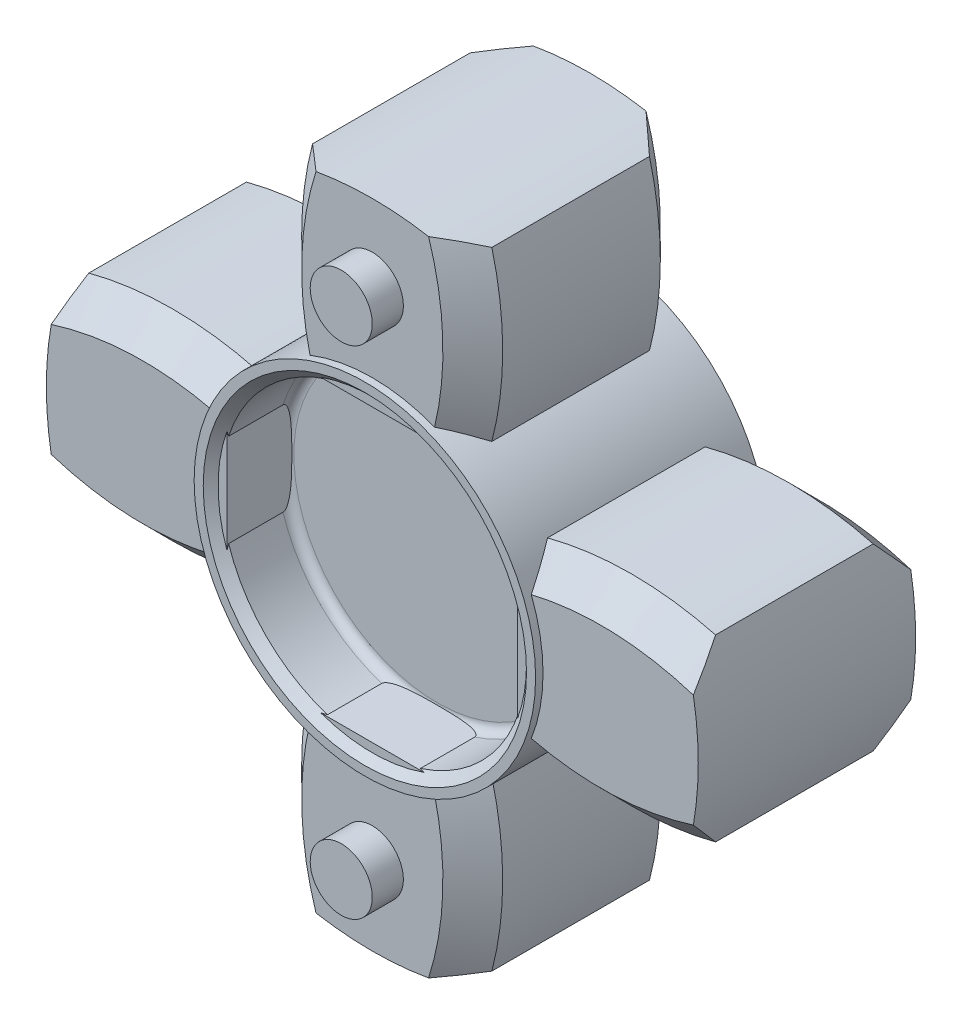
from build123d import *

# Parameters (mm, degrees)
BOSS_EXTRUDE1_DEPTH          = 5.93852
BOSS_EXTRUDE1_DEPTH_BACK     = 5.93852
SKETCH4_R                    = 8.73125
SKETCH4_R_2                  = 7.80161
BOSS_EXTRUDE2_DEPTH          = 2.23266
BOSS_EXTRUDE2_DEPTH_BACK     = 2.23266
SKETCH5_R                    = 7.80161
FILLET1_R                    = 0.46482
CHAMFER1_SIZE                = 0.46482
BOSS_EXTRUDE3_DEPTH          = 5.55879
CHAMFER2_SIZE                = 1.528233333
CIRPATTERN1_COUNT            = 4
CHAMFER2_OF_CIRPATTERN1_SIZE = 1.528233333
SKETCH10_R                   = 1.5875
BOSS_EXTRUDE6_DEPTH          = 7.14629
SKETCH13_R                   = 1.5875
BOSS_EXTRUDE7_DEPTH          = 7.14629
CIRPATTERN2_COUNT            = 2


with BuildPart() as part:
    # Sketch4 → Boss-Extrude1 (new, two sides: drawn at the far end of the back side and taken through both)
    with BuildSketch(Plane.XY.offset(-BOSS_EXTRUDE1_DEPTH_BACK)):
        Circle(SKETCH4_R)
        Circle(SKETCH4_R_2, mode=Mode.SUBTRACT)
    extrude(amount=BOSS_EXTRUDE1_DEPTH + BOSS_EXTRUDE1_DEPTH_BACK)

    # Sketch5 → Boss-Extrude2 (add, two sides: drawn at the far end of the back side and taken through both)
    with BuildSketch(Plane.XY.offset(-BOSS_EXTRUDE2_DEPTH_BACK)):
        Circle(SKETCH5_R)
    extrude(amount=BOSS_EXTRUDE2_DEPTH + BOSS_EXTRUDE2_DEPTH_BACK)

    # Fillet1
    fillet1_edges = [part.edges().sort_by_distance(p)[0] for p in [
        (-7.80161, 0, 2.23266),
        (-7.80161, 0, -2.23266),
    ]]
    fillet(fillet1_edges, radius=FILLET1_R)

    # Chamfer1
    chamfer1_edges = [part.edges().sort_by_distance(p)[0] for p in [
        (-7.80161, 0, 5.93852),
        (-7.80161, 0, -5.93852),
    ]]
    chamfer(chamfer1_edges, length=CHAMFER1_SIZE)

    # Sketch7 → Boss-Extrude3 (add, symmetric)
    with BuildSketch(Plane.XY):
        with BuildLine():
            Line((-4.5847, 7.430696634), (4.5847, 7.430696634))
            ThreePointArc((4.5847, 7.430696634), (5.139699108, 11.728271512), (4.5847, 16.025846389))
            ThreePointArc((4.5847, 16.025846389), (0, 16.66875), (-4.5847, 16.025846389))
            ThreePointArc((-4.5847, 16.025846389), (-5.139699108, 11.728271512), (-4.5847, 7.430696634))
        make_face()
    boss_extrude3 = extrude(amount=BOSS_EXTRUDE3_DEPTH, both=True)

    # Chamfer2
    chamfer2_edges = [part.edges().sort_by_distance(p)[0] for p in [
        (-5.139699108, 11.728271512, -5.55879),
        (5.139699108, 11.728271512, -5.55879),
        (5.139699108, 11.728271512, 5.55879),
        (-5.139699108, 11.728271512, 5.55879),
    ]]
    chamfer(chamfer2_edges, length=CHAMFER2_SIZE)

    # CirPattern1: Boss-Extrude3 ×4 about axis
    cirpattern1_axis = Axis((0, 0, 0), (0, 0, 1))
    for i in range(1, CIRPATTERN1_COUNT):
        add(boss_extrude3.rotate(cirpattern1_axis, i * 360 / CIRPATTERN1_COUNT))

    # Chamfer2 of CirPattern1
    chamfer2_of_cirpattern1_edges = [part.edges().sort_by_distance(p)[0] for p in [
        (-11.728271512, -5.139699108, -5.55879),
        (-11.728271512, 5.139699108, -5.55879),
        (-11.728271512, 5.139699108, 5.55879),
        (-11.728271512, -5.139699108, 5.55879),
        (5.139699108, -11.728271512, -5.55879),
        (-5.139699108, -11.728271512, -5.55879),
        (-5.139699108, -11.728271512, 5.55879),
        (5.139699108, -11.728271512, 5.55879),
        (11.728271512, 5.139699108, -5.55879),
        (11.728271512, -5.139699108, -5.55879),
        (11.728271512, -5.139699108, 5.55879),
        (11.728271512, 5.139699108, 5.55879),
    ]]
    chamfer(chamfer2_of_cirpattern1_edges, length=CHAMFER2_OF_CIRPATTERN1_SIZE)

    # Sketch10 → Boss-Extrude6 (add)
    with BuildSketch(Plane.XY):
        with Locations(Location((0, 12.7, 0), (0, 0, 180))):
            Circle(SKETCH10_R)
    boss_extrude6 = extrude(amount=BOSS_EXTRUDE6_DEPTH)

    # Sketch13 → Boss-Extrude7 (add)
    with BuildSketch(Plane.XY):
        with Locations((12.7, 0)):
            Circle(SKETCH13_R)
    boss_extrude7 = extrude(amount=-BOSS_EXTRUDE7_DEPTH)

    # CirPattern2: Boss-Extrude6, Boss-Extrude7 ×2 about axis
    cirpattern2_axis = Axis((0, 0, 0), (0, 0, 1))
    add([boss_extrude6.rotate(cirpattern2_axis, i * 360 / CIRPATTERN2_COUNT) for i in range(1, CIRPATTERN2_COUNT)])
    add([boss_extrude7.rotate(cirpattern2_axis, i * 360 / CIRPATTERN2_COUNT) for i in range(1, CIRPATTERN2_COUNT)])


solid = part.part
